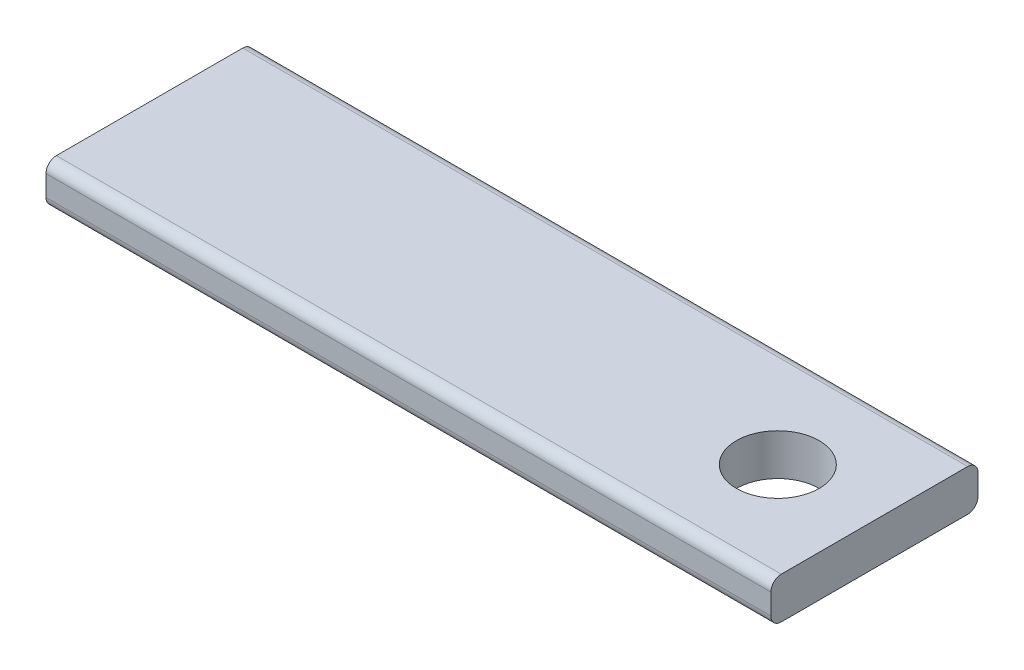
from build123d import *

# Parameters (mm, degrees)
SKETCH_1_W          = 52.5
SKETCH_1_H          = 15
EXTRUDE_1_DEPTH     = 1.5
FILLET_1_R          = 0.75
SKETCH_2_R          = 3
CUT_EXTRUDE_1_DEPTH = 3


with BuildPart() as part:
    # ｽｹｯﾁ1 → ﾎﾞｽ - 押し出し1 (new, symmetric)
    with BuildSketch(Plane(origin=(0, 0, 0), x_dir=(1, 0, 0), z_dir=(0, 1, 0))):
        Rectangle(SKETCH_1_W, SKETCH_1_H)
    extrude(amount=EXTRUDE_1_DEPTH, both=True)

    # ﾌｨﾚｯﾄ1
    fillet_1_edges = [part.edges().sort_by_distance(p)[0] for p in [
        (0, 1.5, 7.5),
        (0, -1.5, 7.5),
        (0, -1.5, -7.5),
        (0, 1.5, -7.5),
    ]]
    fillet(fillet_1_edges, radius=FILLET_1_R)

    # ｽｹｯﾁ2 → ｶｯﾄ - 押し出し1 (cut)
    with BuildSketch(Plane(origin=(0, 1.5, 0), x_dir=(1, 0, 0), z_dir=(0, 1, 0))):
        with Locations(Location((19.25, 0, 0), (0, 0, 270))):
            Circle(SKETCH_2_R)
    extrude(amount=-CUT_EXTRUDE_1_DEPTH, mode=Mode.SUBTRACT)


solid = part.part
